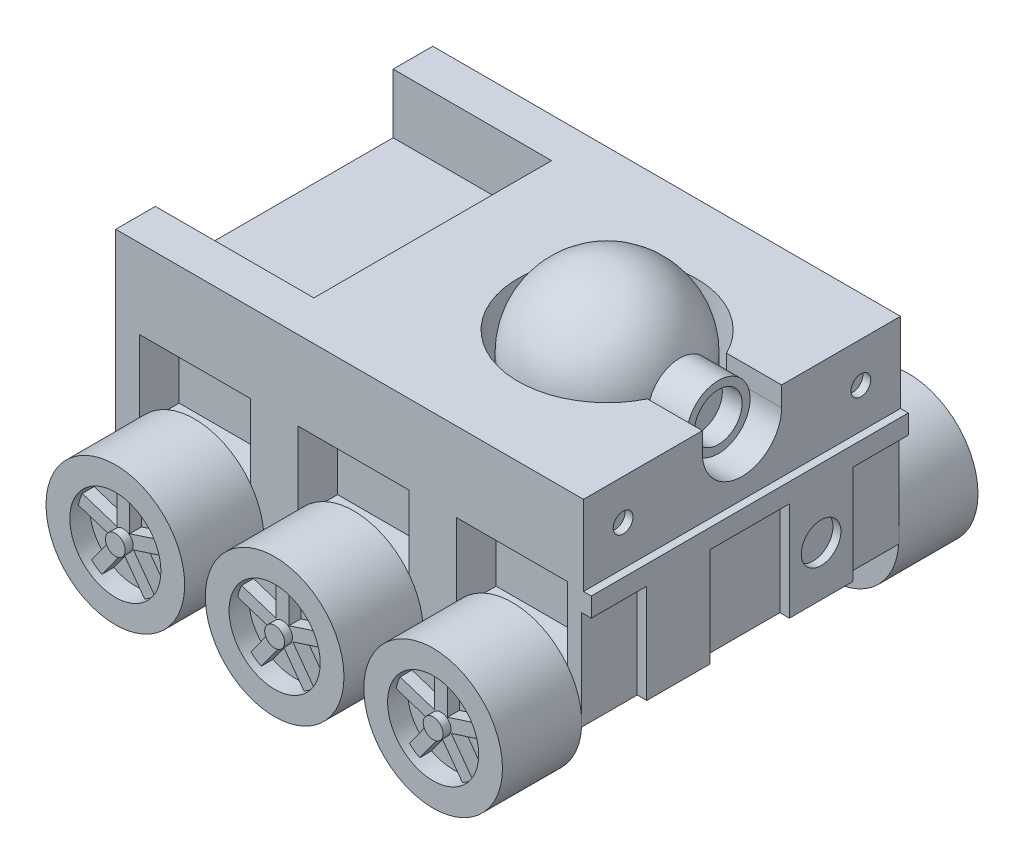
from build123d import *

# Parameters (mm, degrees)
SKETCH1_W                = 76.2
SKETCH1_H                = 31.75
BOSS_EXTRUDE1_DEPTH      = 25.4
CUT_EXTRUDE1_DEPTH       = 9.525
SKETCH3_R                = 12.7
BOSS_EXTRUDE2_DEPTH      = 6.35
BOSS_EXTRUDE3_REACH      = 81.721
BOSS_EXTRUDE3_END_RADIUS = 12.7
SKETCH5_R                = 5.08
SKETCH6_R                = 3.81
CUT_EXTRUDE2_DEPTH       = 3.175
BOSS_EXTRUDE4_DEPTH      = 10.061166
SKETCH11_W               = 1.244695514
SKETCH11_H               = 12.794994947
CUT_EXTRUDE5_DEPTH       = 69.391593051
SKETCH12_W               = 8.89
SKETCH12_H               = 15.875
SKETCH12_W_2             = 12.7
CUT_EXTRUDE6_DEPTH       = 1.524
SKETCH15_W               = 25.4
SKETCH15_H               = 38.1
CUT_EXTRUDE9_DEPTH       = 9.525
SKETCH16_R               = 3.175
CUT_EXTRUDE10_DEPTH      = 1.27
SKETCH17_R               = 1.5875
CUT_EXTRUDE11_DEPTH      = 1.27
SKETCH8_R                = 11.1125
BOSS_EXTRUDE5_DEPTH      = 12.7
CUT_EXTRUDE3_START       = -6.35
CUT_EXTRUDE3_DEPTH       = 6.35
SKETCH10_W               = 17.78
SKETCH10_H               = 6.35
CUT_EXTRUDE4_DEPTH       = 12.7
CUT_EXTRUDE7_DEPTH       = 3.175
SKETCH14_R               = 7.3025
SKETCH14_R_2             = 1.5875
CUT_EXTRUDE8_DEPTH       = 1.27


with BuildPart() as part:
    # Sketch1 → Boss-Extrude1 (new, symmetric)
    with BuildSketch(Plane.XY):
        Rectangle(SKETCH1_W, SKETCH1_H)
    extrude(amount=BOSS_EXTRUDE1_DEPTH, both=True)

    # Sketch2 → Cut-Extrude1 (cut)
    with BuildSketch(Plane(origin=(0, 15.875, 0), x_dir=(1, 0, 0), z_dir=(0, 1, 0))):
        with BuildLine():
            Line((28.038834175, 6.35), (38.1, 6.35))
            Line((38.1, 6.35), (38.1, -6.35))
            Line((38.1, -6.35), (28.038834175, -6.35))
            ThreePointArc((28.038834175, -6.35), (0.9525, 0), (28.038834175, 6.35))
        make_face()
    extrude(amount=-CUT_EXTRUDE1_DEPTH, mode=Mode.SUBTRACT)

    # Sketch3 → Boss-Extrude2 (add)
    with BuildSketch(Plane(origin=(0, 6.35, 0), x_dir=(1, 0, 0), z_dir=(0, 1, 0))):
        with Locations(Location((15.24, 0, 0), (0, 0, 180))):
            Circle(SKETCH3_R)
    extrude(amount=BOSS_EXTRUDE2_DEPTH)

    # Sketch4 → Revolve1 (revolve)
    with BuildSketch(Plane.XY):
        with BuildLine():
            Line((15.24, 12.7), (15.24, 25.4))
            ThreePointArc((15.24, 25.4), (24.220256121, 21.680256121), (27.94, 12.7))
            Line((27.94, 12.7), (15.24, 12.7))
        make_face()
    revolve(axis=Axis((15.24, 12.7, 0), (0, 1, 0)))

    # Boss-Extrude3: up to this sphere (the profile starts outside it)
    boss_extrude3_end = Location((15.24, 12.7, 0)) * Sphere(BOSS_EXTRUDE3_END_RADIUS, mode=Mode.PRIVATE)
    # Sketch5 → Boss-Extrude3 (add, up to the surface)
    with BuildSketch(Plane(origin=(33.069417088, 0, 0), x_dir=(0, 0, -1), z_dir=(1, 0, 0)), mode=Mode.PRIVATE) as boss_extrude3_sk1:
        with Locations((0, 12.7)):
            Circle(SKETCH5_R)
    boss_extrude3_tool1 = extrude(boss_extrude3_sk1.sketch, amount=-BOSS_EXTRUDE3_REACH, mode=Mode.PRIVATE) - boss_extrude3_end
    add(boss_extrude3_tool1.solids().sort_by_distance((33.069417, 12.7, 0))[0])

    # Sketch6 → Cut-Extrude2 (cut)
    with BuildSketch(Plane(origin=(33.069417088, 0, 0), x_dir=(0, 0, -1), z_dir=(1, 0, 0))):
        with Locations((0, 12.7)):
            Circle(SKETCH6_R)
    extrude(amount=-CUT_EXTRUDE2_DEPTH, mode=Mode.SUBTRACT)

    # Sketch7 → Boss-Extrude4 (add)
    with BuildSketch(Plane(origin=(38.1, 0, 0), x_dir=(0, 0, -1), z_dir=(1, 0, 0))):
        with BuildLine():
            Line((-6.35, 6.35), (0, 6.35))
            ThreePointArc((0, 6.35), (-4.490128061, 8.209871939), (-6.35, 12.7))
            Line((-6.35, 12.7), (-6.35, 6.35))
        make_face()
        with BuildLine():
            Line((0, 6.35), (6.35, 6.35))
            Line((6.35, 6.35), (6.35, 12.7))
            ThreePointArc((6.35, 12.7), (4.490128061, 8.209871939), (0, 6.35))
        make_face()
    extrude(amount=-BOSS_EXTRUDE4_DEPTH)

    # Sketch11 → Cut-Extrude5 (cut, through all)
    with BuildSketch(Plane.XY.offset(25.4)):
        with Locations((37.477652243, 9.477502527)):
            Rectangle(SKETCH11_W, SKETCH11_H)
    extrude(amount=-CUT_EXTRUDE5_DEPTH, mode=Mode.SUBTRACT)

    # Sketch12 → Cut-Extrude6 (cut)
    with BuildSketch(Plane(origin=(38.1, 0, 0), x_dir=(0, 0, -1), z_dir=(1, 0, 0))):
        with Locations((-20.955, -7.9375)):
            Rectangle(SKETCH12_W, SKETCH12_H)
        with Locations((20.955, -7.9375)):
            Rectangle(SKETCH12_W, SKETCH12_H)
        with Locations((0, -7.9375)):
            Rectangle(SKETCH12_W_2, SKETCH12_H)
    extrude(amount=-CUT_EXTRUDE6_DEPTH, mode=Mode.SUBTRACT)

    # Sketch15 → Cut-Extrude9 (cut)
    with BuildSketch(Plane(origin=(0, 15.875, 0), x_dir=(1, 0, 0), z_dir=(0, 1, 0))):
        with Locations((-25.4, 0)):
            Rectangle(SKETCH15_W, SKETCH15_H)
    extrude(amount=-CUT_EXTRUDE9_DEPTH, mode=Mode.SUBTRACT)

    # Sketch16 → Cut-Extrude10 (cut)
    with BuildSketch(Plane(origin=(38.1, 0, 0), x_dir=(0, 0, -1), z_dir=(1, 0, 0))):
        with Locations((11.43, -7.9375)):
            Circle(SKETCH16_R)
    extrude(amount=-CUT_EXTRUDE10_DEPTH, mode=Mode.SUBTRACT)

    # Sketch17 → Cut-Extrude11 (cut)
    with BuildSketch(Plane(origin=(36.855304486, 0, 0), x_dir=(0, 0, -1), z_dir=(1, 0, 0))):
        with Locations((-19.05, 9.477502526)):
            Circle(SKETCH17_R)
        with Locations((19.05, 9.477502526)):
            Circle(SKETCH17_R)
    extrude(amount=-CUT_EXTRUDE11_DEPTH, mode=Mode.SUBTRACT)

    # Sketch8 → Boss-Extrude5 (add)
    with BuildSketch(Plane.XY.offset(25.4)):
        with Locations(Location((0.062076712, -15.24, 0), (0, 0, 183.27582896))):
            Circle(SKETCH8_R)
        with Locations(Location((25.462076712, -15.24, 0), (0, 0, 183.27582896))):
            Circle(SKETCH8_R)
        with Locations(Location((-25.462076712, -15.24, 0), (0, 0, 180))):
            Circle(SKETCH8_R)
    boss_extrude5 = extrude(amount=BOSS_EXTRUDE5_DEPTH)

    # Sketch9 → Cut-Extrude3 (cut)
    with BuildSketch(Plane.XY.offset(25.4).offset(CUT_EXTRUDE3_START)):
        with BuildLine():
            Line((16.51, 3.175), (34.29, 3.175))
            Line((34.29, 3.175), (34.29, -8.490523971))
            ThreePointArc((34.29, -8.490523971), (25.358607551, -4.127981714), (16.51, -8.656081805))
            Line((16.51, -8.656081805), (16.51, 3.175))
        make_face()
        with BuildLine():
            Line((-8.89, 3.175), (8.89, 3.175))
            Line((8.89, 3.175), (8.89, -8.490523971))
            ThreePointArc((8.89, -8.490523971), (-0.041392449, -4.127981714), (-8.89, -8.656081805))
            Line((-8.89, -8.656081805), (-8.89, 3.175))
        make_face()
        with BuildLine():
            Line((-34.29, 3.175), (-16.51, 3.175))
            Line((-16.51, 3.175), (-16.51, -8.490523971))
            ThreePointArc((-16.51, -8.490523971), (-25.441392449, -4.127981714), (-34.29, -8.656081805))
            Line((-34.29, -8.656081805), (-34.29, 3.175))
        make_face()
    cut_extrude3 = extrude(amount=CUT_EXTRUDE3_DEPTH, mode=Mode.SUBTRACT)

    # Sketch10 → Cut-Extrude4 (cut)
    with BuildSketch(Plane.XZ.offset(-3.175)):
        with Locations((25.4, 22.225)):
            Rectangle(SKETCH10_W, SKETCH10_H)
        with Locations((0, 22.225)):
            Rectangle(SKETCH10_W, SKETCH10_H)
        with Locations((-25.4, 22.225)):
            Rectangle(SKETCH10_W, SKETCH10_H)
    cut_extrude4 = extrude(amount=CUT_EXTRUDE4_DEPTH, mode=Mode.SUBTRACT)

    # Sketch13 → Cut-Extrude7 (cut)
    with BuildSketch(Plane.XY.offset(38.1)):
        with BuildLine():
            Line((25.462076712, -16.968522443), (22.033482825, -21.687577081))
            ThreePointArc((22.033482825, -21.687577081), (25.462076712, -22.5425), (28.890670598, -21.687577081))
            Line((28.890670598, -21.687577081), (25.462076712, -16.968522443))
        make_face()
        with BuildLine():
            Line((23.818154179, -15.77414281), (18.270572737, -13.971624333))
            ThreePointArc((18.270572737, -13.971624333), (18.516986502, -17.496596601), (20.389560293, -20.493197448))
            Line((20.389560293, -20.493197448), (23.818154179, -15.77414281))
        make_face()
        with BuildLine():
            Line((27.105999244, -15.77414281), (32.653580686, -13.971624333))
            ThreePointArc((32.653580686, -13.971624333), (32.407166922, -17.496596601), (30.534593131, -20.493197448))
            Line((30.534593131, -20.493197448), (27.105999244, -15.77414281))
        make_face()
        with BuildLine():
            Line((0.062076712, -16.968522443), (-3.366517175, -21.687577081))
            ThreePointArc((-3.366517175, -21.687577081), (0.062076712, -22.5425), (3.490670598, -21.687577081))
            Line((3.490670598, -21.687577081), (0.062076712, -16.968522443))
        make_face()
        with BuildLine():
            Line((-1.581845821, -15.77414281), (-7.129427263, -13.971624333))
            ThreePointArc((-7.129427263, -13.971624333), (-6.883013498, -17.496596601), (-5.010439707, -20.493197448))
            Line((-5.010439707, -20.493197448), (-1.581845821, -15.77414281))
        make_face()
        with BuildLine():
            Line((26.478076712, -13.841595969), (32.025658154, -12.039077492))
            ThreePointArc((32.025658154, -12.039077492), (29.754378517, -9.332153399), (26.478076712, -8.008523647))
            Line((26.478076712, -8.008523647), (26.478076712, -13.841595969))
        make_face()
        with BuildLine():
            Line((1.705999244, -15.77414281), (7.253580686, -13.971624333))
            ThreePointArc((7.253580686, -13.971624333), (7.007166922, -17.496596601), (5.134593131, -20.493197448))
            Line((5.134593131, -20.493197448), (1.705999244, -15.77414281))
        make_face()
        with BuildLine():
            Line((24.446076712, -13.841595969), (18.89849527, -12.039077492))
            ThreePointArc((18.89849527, -12.039077492), (21.169774907, -9.332153399), (24.446076712, -8.008523647))
            Line((24.446076712, -8.008523647), (24.446076712, -13.841595969))
        make_face()
        with BuildLine():
            Line((1.078076712, -13.841595969), (6.625658154, -12.039077492))
            ThreePointArc((6.625658154, -12.039077492), (4.354378517, -9.332153399), (1.078076712, -8.008523647))
            Line((1.078076712, -8.008523647), (1.078076712, -13.841595969))
        make_face()
        with BuildLine():
            Line((-25.462076712, -16.968522443), (-28.890670598, -21.687577081))
            ThreePointArc((-28.890670598, -21.687577081), (-25.462076712, -22.5425), (-22.033482825, -21.687577081))
            Line((-22.033482825, -21.687577081), (-25.462076712, -16.968522443))
        make_face()
        with BuildLine():
            Line((-27.105999244, -15.77414281), (-32.653580686, -13.971624333))
            ThreePointArc((-32.653580686, -13.971624333), (-32.407166922, -17.496596601), (-30.534593131, -20.493197448))
            Line((-30.534593131, -20.493197448), (-27.105999244, -15.77414281))
        make_face()
        with BuildLine():
            Line((-23.818154179, -15.77414281), (-18.270572737, -13.971624333))
            ThreePointArc((-18.270572737, -13.971624333), (-18.516986502, -17.496596601), (-20.389560293, -20.493197448))
            Line((-20.389560293, -20.493197448), (-23.818154179, -15.77414281))
        make_face()
        with BuildLine():
            Line((-0.953923288, -13.841595969), (-6.50150473, -12.039077492))
            ThreePointArc((-6.50150473, -12.039077492), (-4.230225093, -9.332153399), (-0.953923288, -8.008523647))
            Line((-0.953923288, -8.008523647), (-0.953923288, -13.841595969))
        make_face()
        with BuildLine():
            Line((-24.446076712, -13.841595969), (-18.89849527, -12.039077492))
            ThreePointArc((-18.89849527, -12.039077492), (-21.169774907, -9.332153399), (-24.446076712, -8.008523647))
            Line((-24.446076712, -8.008523647), (-24.446076712, -13.841595969))
        make_face()
        with BuildLine():
            Line((-26.478076712, -13.841595969), (-32.025658154, -12.039077492))
            ThreePointArc((-32.025658154, -12.039077492), (-29.754378517, -9.332153399), (-26.478076712, -8.008523647))
            Line((-26.478076712, -8.008523647), (-26.478076712, -13.841595969))
        make_face()
    cut_extrude7 = extrude(amount=-CUT_EXTRUDE7_DEPTH, mode=Mode.SUBTRACT)

    # Sketch14 → Cut-Extrude8 (cut)
    # profile 1 of 3: a face of its own
    with BuildSketch(Plane.XY.offset(38.1)):
        with Locations((0.062076712, -15.24)):
            Circle(SKETCH14_R)
        with Locations((0.062076712, -15.24)):
            Circle(SKETCH14_R_2, mode=Mode.SUBTRACT)
    # profile 2 of 3: a face of its own
    with BuildSketch(Plane.XY.offset(38.1)):
        with Locations((25.462076712, -15.24)):
            Circle(SKETCH14_R)
        with Locations((25.462076712, -15.24)):
            Circle(SKETCH14_R_2, mode=Mode.SUBTRACT)
    # profile 3 of 3: a face of its own
    with BuildSketch(Plane.XY.offset(38.1)):
        with Locations((-25.462076712, -15.24)):
            Circle(SKETCH14_R)
        with Locations((-25.462076712, -15.24)):
            Circle(SKETCH14_R_2, mode=Mode.SUBTRACT)
    cut_extrude8 = extrude(amount=-CUT_EXTRUDE8_DEPTH, mode=Mode.SUBTRACT)

    # Mirror1: Boss-Extrude5, Cut-Extrude3, Cut-Extrude4, Cut-Extrude7, Cut-Extrude8 across plane
    add(boss_extrude5.mirror(Plane.XY))
    add(cut_extrude3.mirror(Plane.XY), mode=Mode.SUBTRACT)
    add(cut_extrude4.mirror(Plane.XY), mode=Mode.SUBTRACT)
    add(cut_extrude7.mirror(Plane.XY), mode=Mode.SUBTRACT)
    add(cut_extrude8.mirror(Plane.XY), mode=Mode.SUBTRACT)


solid = part.part
